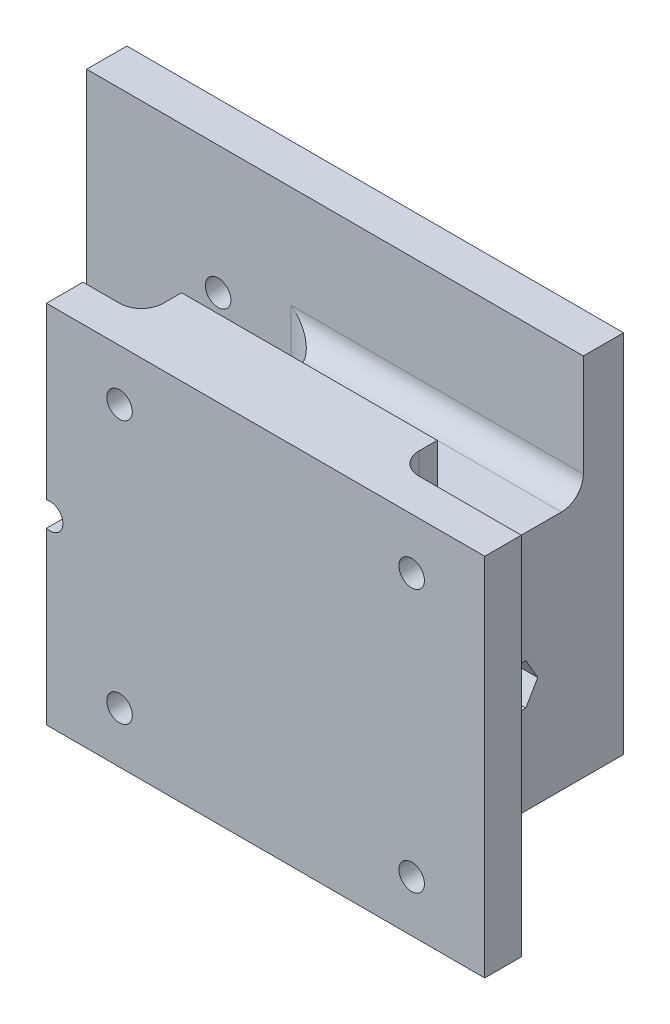
from build123d import *

# Parameters (mm, degrees)
SKETCH1_W                      = 60
SKETCH1_H                      = 50
BOSS_EXTRUDE1_DEPTH            = 5
CUT_EXTRUDE1_DEPTH             = 40.37003937
CUT_EXTRUDE1_DEPTH_BACK        = 40.37003937
SKETCH5_R                      = 1.75
BOSS_EXTRUDE2_START            = -17
BOSS_EXTRUDE2_DEPTH            = 35
SKETCH6_W                      = 5.5
SKETCH6_H                      = 50
BOSS_EXTRUDE3_DEPTH            = 33
CUT_EXTRUDE2_DEPTH             = 71.32780389
CUT_EXTRUDE2_DEPTH_BACK        = 71.32780389
SKETCH7_R                      = 1.75
FILLET2_R                      = 3
FILLET3_R                      = 3
SKETCH8_W                      = 21
SKETCH8_H                      = 21
CUT_EXTRUDE3_DEPTH             = 28
FILLET4_R                      = 5
CBORE_FOR_M3_SHCS1_D           = 3.4
CBORE_FOR_M3_SHCS1_CBORE_D     = 6.5
CBORE_FOR_M3_SHCS1_CBORE_DEPTH = 3
SKETCH16_R                     = 1.7
CUT_EXTRUDE4_DEPTH             = 3
CHAMFER1_SIZE                  = 4


with BuildPart() as part:
    # Sketch1 → Boss-Extrude1 (new body)
    with BuildSketch(Plane.XY):
        Rectangle(SKETCH1_W, SKETCH1_H)
    extrude(amount=BOSS_EXTRUDE1_DEPTH)

    # Sketch5 → Cut-Extrude1 (cut, two sides: drawn at the far end of the back side and taken through both)
    with BuildSketch(Plane.XY.offset(5).offset(-CUT_EXTRUDE1_DEPTH_BACK)):
        with Locations((-20, 18)):
            Circle(SKETCH5_R)
        with Locations((20, 18)):
            Circle(SKETCH5_R)
        with Locations((20, -18)):
            Circle(SKETCH5_R)
        with Locations((-20, -18)):
            Circle(SKETCH5_R)
    extrude(amount=CUT_EXTRUDE1_DEPTH + CUT_EXTRUDE1_DEPTH_BACK, mode=Mode.SUBTRACT)

    # Sketch2 → Boss-Extrude2 (add)
    with BuildSketch(Plane(origin=(30, 0, 0), x_dir=(0, 0, -1), z_dir=(1, 0, 0)).offset(BOSS_EXTRUDE2_START)):
        Polygon((0, -25), (31, -25), (31, 25), (25.5, 25), (25.5, 8), (5.5, 8), (5.5, 25), (0, 25), align=None)
    extrude(amount=-BOSS_EXTRUDE2_DEPTH)

    # Sketch6 → Boss-Extrude3 (add)
    with BuildSketch(Plane.ZY.offset(22)):
        with Locations((-28.25, 0)):
            Rectangle(SKETCH6_W, SKETCH6_H)
    extrude(amount=BOSS_EXTRUDE3_DEPTH)

    # Sketch7 → Cut-Extrude2 (cut, two sides: drawn at the far end of the back side and taken through both)
    with BuildSketch(Plane(origin=(0, 0, -31), x_dir=(-1, 0, 0), z_dir=(0, 0, -1)).offset(-CUT_EXTRUDE2_DEPTH_BACK)):
        with Locations((37, 7.5)):
            Circle(SKETCH7_R)
        with Locations((44.5, 0)):
            Circle(SKETCH7_R)
        with Locations((37, -7.5)):
            Circle(SKETCH7_R)
        with Locations((29.5, 0)):
            Circle(SKETCH7_R)
    extrude(amount=CUT_EXTRUDE2_DEPTH + CUT_EXTRUDE2_DEPTH_BACK, mode=Mode.SUBTRACT)

    # Fillet2
    fillet2_edges = [part.edges().sort_by_distance(p)[0] for p in [
        (13, 0, 0),
        (-22, 0, 0),
    ]]
    fillet(fillet2_edges, radius=FILLET2_R)

    # Fillet3
    fillet3_edges = [part.edges().sort_by_distance(p)[0] for p in [
        (-4.5, 8, -25.5),
        (-4.5, 8, -5.5),
    ]]
    fillet(fillet3_edges, radius=FILLET3_R)

    # Sketch8 → Cut-Extrude3 (cut)
    with BuildSketch(Plane(origin=(0, 0, -31), x_dir=(-1, 0, 0), z_dir=(0, 0, -1))):
        with Locations((5, -10)):
            Rectangle(SKETCH8_W, SKETCH8_H)
    extrude(amount=-CUT_EXTRUDE3_DEPTH, mode=Mode.SUBTRACT)

    # Fillet4
    fillet4_edges = [part.edges().sort_by_distance(p)[0] for p in [
        (-22, -7, -25.5),
    ]]
    fillet(fillet4_edges, radius=FILLET4_R)

    # CBORE for M3 SHCS1 (through all)
    with Locations(Plane.ZY.offset(22)):
        with Locations((-7.5, -10), (-16, -10)):
            CounterBoreHole(CBORE_FOR_M3_SHCS1_D / 2, CBORE_FOR_M3_SHCS1_CBORE_D / 2, CBORE_FOR_M3_SHCS1_CBORE_DEPTH)

    # Sketch16 → Cut-Extrude4 (cut)
    # profile 1 of 2: a face of its own
    with BuildSketch(Plane(origin=(13, 0, 0), x_dir=(0, 0, -1), z_dir=(1, 0, 0))):
        Polygon((9.125, -12.814582562), (10.75, -10), (9.125, -7.185417438), (5.875, -7.185417438), (4.25, -10), (5.875, -12.814582562), align=None)
        with Locations((7.5, -10)):
            Circle(SKETCH16_R, mode=Mode.SUBTRACT)
    # profile 2 of 2: a face of its own
    with BuildSketch(Plane(origin=(13, 0, 0), x_dir=(0, 0, -1), z_dir=(1, 0, 0))):
        Polygon((17.625, -12.814582562), (19.25, -10), (17.625, -7.185417438), (14.375, -7.185417438), (12.75, -10), (14.375, -12.814582562), align=None)
        with Locations((16, -10)):
            Circle(SKETCH16_R, mode=Mode.SUBTRACT)
    extrude(amount=-CUT_EXTRUDE4_DEPTH, mode=Mode.SUBTRACT)

    # Chamfer1
    chamfer1_edges = [part.edges().sort_by_distance(p)[0] for p in [
        (5.5, -10, -31),
        (-5, -20.5, -31),
        (-5, 0.5, -31),
        (-15.5, -10, -31),
    ]]
    chamfer(chamfer1_edges, length=CHAMFER1_SIZE)


solid = part.part
